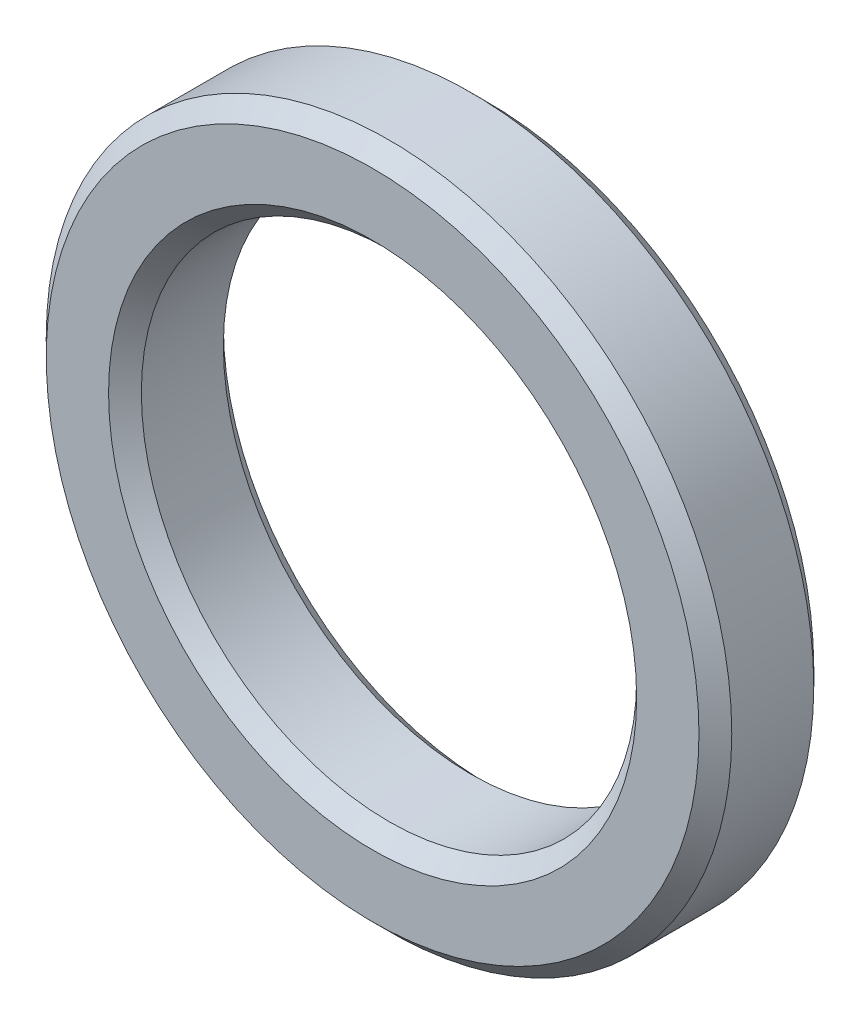
from build123d import *


with BuildPart() as part:
    # Sketch1 → Revolve1 (revolve)
    with BuildSketch(Plane(origin=(0, 0, 0), x_dir=(0, 0, -1), z_dir=(1, 0, 0)), mode=Mode.PRIVATE) as revolve1_sk:
        Polygon((1, 15.1), (0, 16.1), (0, 19.9), (1, 20.9), (6, 20.9), (7, 19.9), (7, 16.1), (6, 15.1), align=None)
    revolve(revolve1_sk.sketch.rotate(Axis((0, 0, 0), (0, 0, -1)), 90), axis=Axis((0, 0, 0), (0, 0, -1)))


solid = part.part
